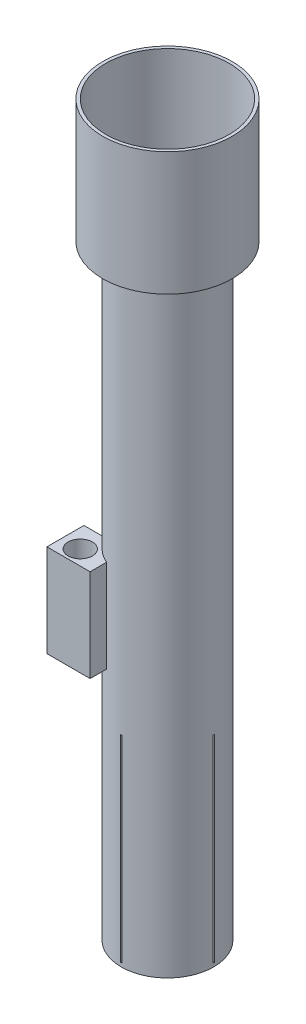
from build123d import *

# Parameters (mm, degrees)
SKETCH1_R           = 9.525
BOSS_EXTRUDE1_DEPTH = 150
SKETCH2_R           = 9.144
CUT_EXTRUDE1_DEPTH  = 177.8
CUT_EXTRUDE3_START  = 10.16
SKETCH3_W           = 0.254
SKETCH3_H           = 40.64
CUT_EXTRUDE3_DEPTH  = 1.27
CIRPATTERN1_COUNT   = 4
SKETCH9_R           = 13.335
BOSS_EXTRUDE2_DEPTH = 25.4
SKETCH10_R          = 12.7
CUT_EXTRUDE5_DEPTH  = 24.13
CUT_EXTRUDE6_START  = -24.13
SKETCH11_R          = 9.144
CUT_EXTRUDE6_DEPTH  = 24.13
BOSS_EXTRUDE3_START = 50.8
SKETCH12_W          = 8.89
SKETCH12_H          = 7.62
BOSS_EXTRUDE3_DEPTH = 19.05
SKETCH13_R          = 2.5
CUT_EXTRUDE7_DEPTH  = 19.05
CUT_EXTRUDE8_START  = 60.96
SKETCH14_R          = 9.144
CUT_EXTRUDE8_DEPTH  = 60.96


with BuildPart() as part:
    # Sketch1 → Boss-Extrude1 (new body)
    with BuildSketch(Plane(origin=(0, 0, 0), x_dir=(1, 0, 0), z_dir=(0, 1, 0))):
        with Locations(Location((0, 0, 0), (0, 0, 270))):
            Circle(SKETCH1_R)
    extrude(amount=BOSS_EXTRUDE1_DEPTH)

    # Sketch2 → Cut-Extrude1 (cut)
    with BuildSketch(Plane(origin=(0, 150, 0), x_dir=(1, 0, 0), z_dir=(0, 1, 0))):
        with Locations(Location((0, 0, 0), (0, 0, 270))):
            Circle(SKETCH2_R)
    extrude(amount=-CUT_EXTRUDE1_DEPTH, mode=Mode.SUBTRACT)

    # Sketch3 → Cut-Extrude3 (cut)
    with BuildSketch(Plane(origin=(0, 0, 0), x_dir=(0, 0, -1), z_dir=(1, 0, 0)).offset(CUT_EXTRUDE3_START)):
        with Locations((0, 21.082)):
            Rectangle(SKETCH3_W, SKETCH3_H)
    cut_extrude3 = extrude(amount=-CUT_EXTRUDE3_DEPTH, mode=Mode.SUBTRACT)

    # CirPattern1: Cut-Extrude3 ×4 about axis
    cirpattern1_axis = Axis((0, 0, 0), (0, 1, 0))
    for i in range(1, CIRPATTERN1_COUNT):
        add(cut_extrude3.rotate(cirpattern1_axis, i * 360 / CIRPATTERN1_COUNT), mode=Mode.SUBTRACT)

    # Sketch9 → Boss-Extrude2 (add)
    with BuildSketch(Plane(origin=(0, 150, 0), x_dir=(1, 0, 0), z_dir=(0, 1, 0))):
        with Locations(Location((0, 0, 0), (0, 0, 270))):
            Circle(SKETCH9_R)
    extrude(amount=-BOSS_EXTRUDE2_DEPTH)

    # Sketch10 → Cut-Extrude5 (cut)
    with BuildSketch(Plane(origin=(0, 150, 0), x_dir=(1, 0, 0), z_dir=(0, 1, 0))):
        with Locations(Location((0, 0, 0), (0, 0, 270))):
            Circle(SKETCH10_R)
    extrude(amount=-CUT_EXTRUDE5_DEPTH, mode=Mode.SUBTRACT)

    # Sketch11 → Cut-Extrude6 (cut)
    with BuildSketch(Plane.XZ.offset(-124.6).offset(CUT_EXTRUDE6_START)):
        with Locations(Location((0, 0, 0), (0, 0, 90))):
            Circle(SKETCH11_R)
    extrude(amount=CUT_EXTRUDE6_DEPTH, mode=Mode.SUBTRACT)

    # Sketch12 → Boss-Extrude3 (add)
    with BuildSketch(Plane(origin=(0, 0, 0), x_dir=(1, 0, 0), z_dir=(0, 1, 0)).offset(BOSS_EXTRUDE3_START)):
        with Locations((-8.255, -8.305027858)):
            Rectangle(SKETCH12_W, SKETCH12_H)
    extrude(amount=BOSS_EXTRUDE3_DEPTH)

    # Sketch13 → Cut-Extrude7 (cut)
    with BuildSketch(Plane(origin=(0, 69.85, 0), x_dir=(1, 0, 0), z_dir=(0, 1, 0))):
        with Locations(Location((-8.89, -9.067027858, 0), (0, 0, 270))):
            Circle(SKETCH13_R)
    extrude(amount=-CUT_EXTRUDE7_DEPTH, mode=Mode.SUBTRACT)

    # Sketch14 → Cut-Extrude8 (cut)
    with BuildSketch(Plane(origin=(0, 0, 0), x_dir=(1, 0, 0), z_dir=(0, 1, 0)).offset(CUT_EXTRUDE8_START)):
        with Locations(Location((0, 0, 0), (0, 0, 270))):
            Circle(SKETCH14_R)
    extrude(amount=-CUT_EXTRUDE8_DEPTH, mode=Mode.SUBTRACT)


solid = part.part
